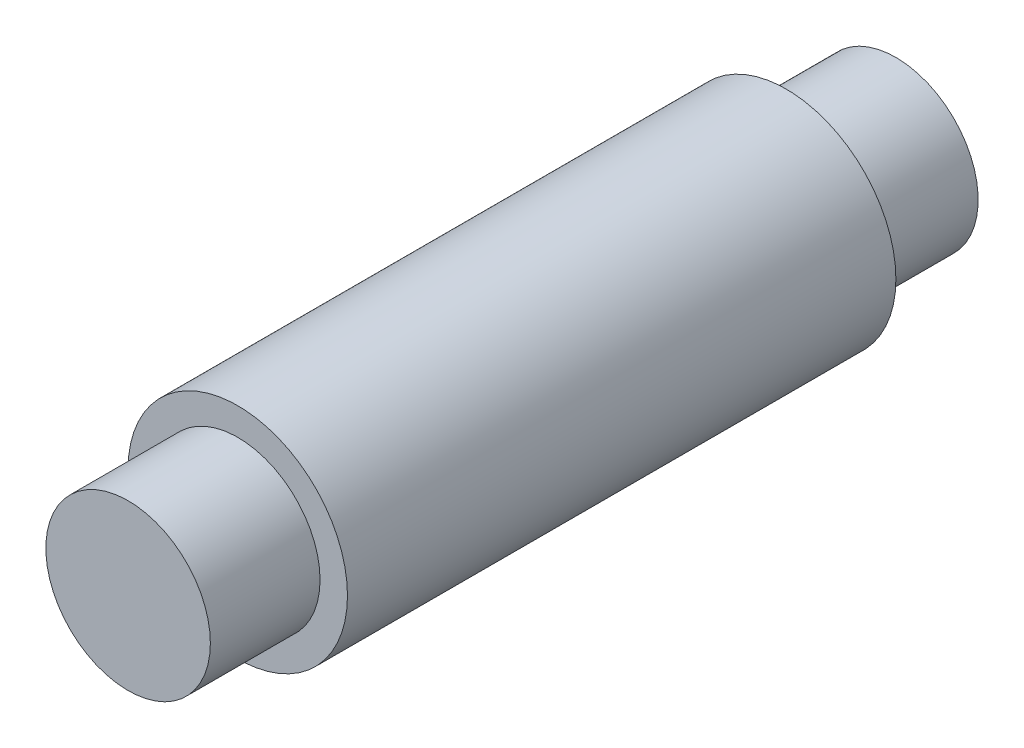
from build123d import *

# Parameters (mm, degrees)
BOSS_EXTRUDE1_START = 44.45
SKETCH1_R           = 12.7
BOSS_EXTRUDE1_DEPTH = 88.9
SKETCH2_R           = 12.7
SKETCH2_R_2         = 9.525
CUT_EXTRUDE1_DEPTH  = 12.7
CUT_EXTRUDE2_START  = -12.7
SKETCH3_R           = 12.7
SKETCH3_R_2         = 9.525
CUT_EXTRUDE2_DEPTH  = 12.7


with BuildPart() as part:
    # Sketch1 → Boss-Extrude1 (new body)
    with BuildSketch(Plane.XY.offset(BOSS_EXTRUDE1_START)):
        Circle(SKETCH1_R)
    extrude(amount=-BOSS_EXTRUDE1_DEPTH)

    # Sketch2 → Cut-Extrude1 (cut)
    with BuildSketch(Plane.XY.offset(44.45)):
        Circle(SKETCH2_R)
        Circle(SKETCH2_R_2, mode=Mode.SUBTRACT)
    extrude(amount=-CUT_EXTRUDE1_DEPTH, mode=Mode.SUBTRACT)

    # Sketch3 → Cut-Extrude2 (cut)
    with BuildSketch(Plane(origin=(0, 0, -44.45), x_dir=(-1, 0, 0), z_dir=(0, 0, -1)).offset(CUT_EXTRUDE2_START)):
        with Locations(Location((0, 0, 0), (0, 0, 180))):
            Circle(SKETCH3_R)
        with Locations(Location((0, 0, 0), (0, 0, 180))):
            Circle(SKETCH3_R_2, mode=Mode.SUBTRACT)
    extrude(amount=CUT_EXTRUDE2_DEPTH, mode=Mode.SUBTRACT)


solid = part.part
